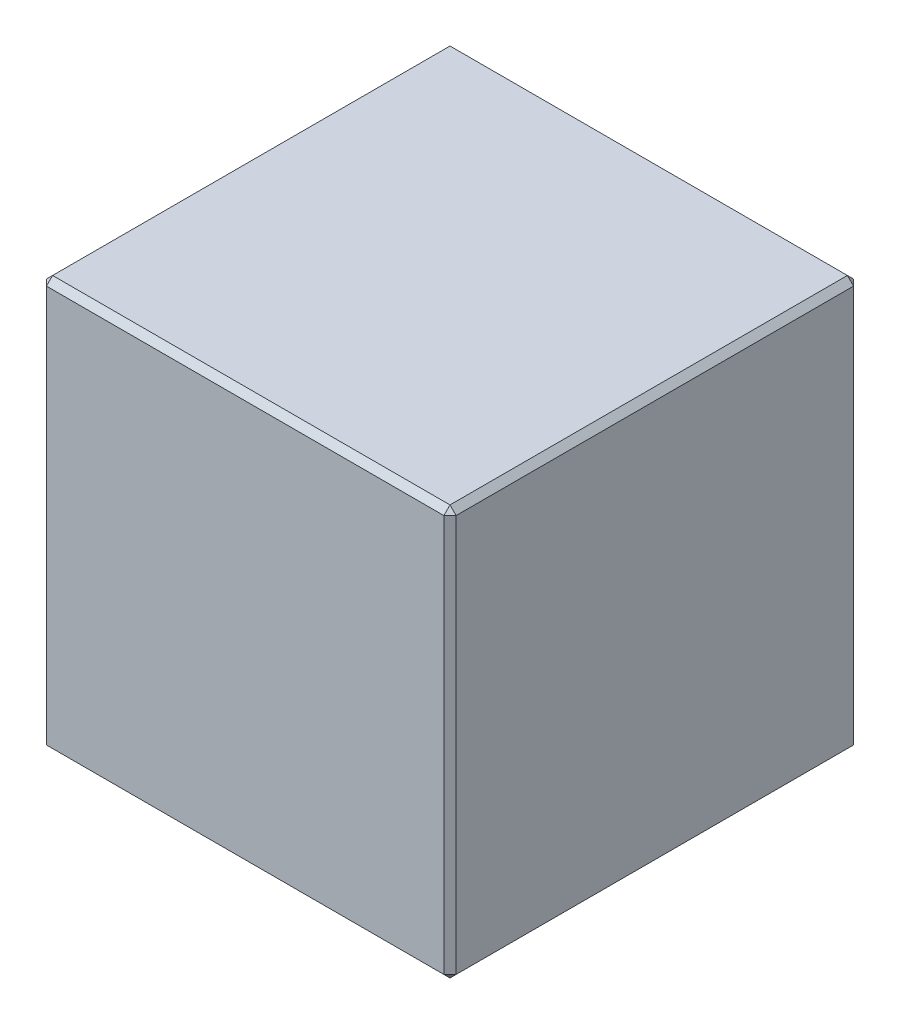
from build123d import *

# Parameters (mm, degrees)
SKETCH1_W           = 40
SKETCH1_H           = 40
BOSS_EXTRUDE1_DEPTH = 40
CHAMFER1_SIZE       = 0.6


with BuildPart() as part:
    # Sketch1 → Boss-Extrude1 (new body)
    with BuildSketch(Plane(origin=(0, 0, 0), x_dir=(1, 0, 0), z_dir=(0, 1, 0))):
        with Locations((20, 20)):
            Rectangle(SKETCH1_W, SKETCH1_H)
    extrude(amount=BOSS_EXTRUDE1_DEPTH)

    # Chamfer1
    chamfer1_edges = [part.edges().sort_by_distance(p)[0] for p in [
        (40, 0, -20),
        (0, 0, -20),
        (40, 40, -20),
        (40, 20, -40),
        (20, 40, -40),
        (20, 0, -40),
        (0, 20, -40),
        (0, 40, -20),
        (0, 20, 0),
        (20, 40, 0),
        (40, 20, 0),
        (20, 0, 0),
    ]]
    chamfer(chamfer1_edges, length=CHAMFER1_SIZE)


solid = part.part
